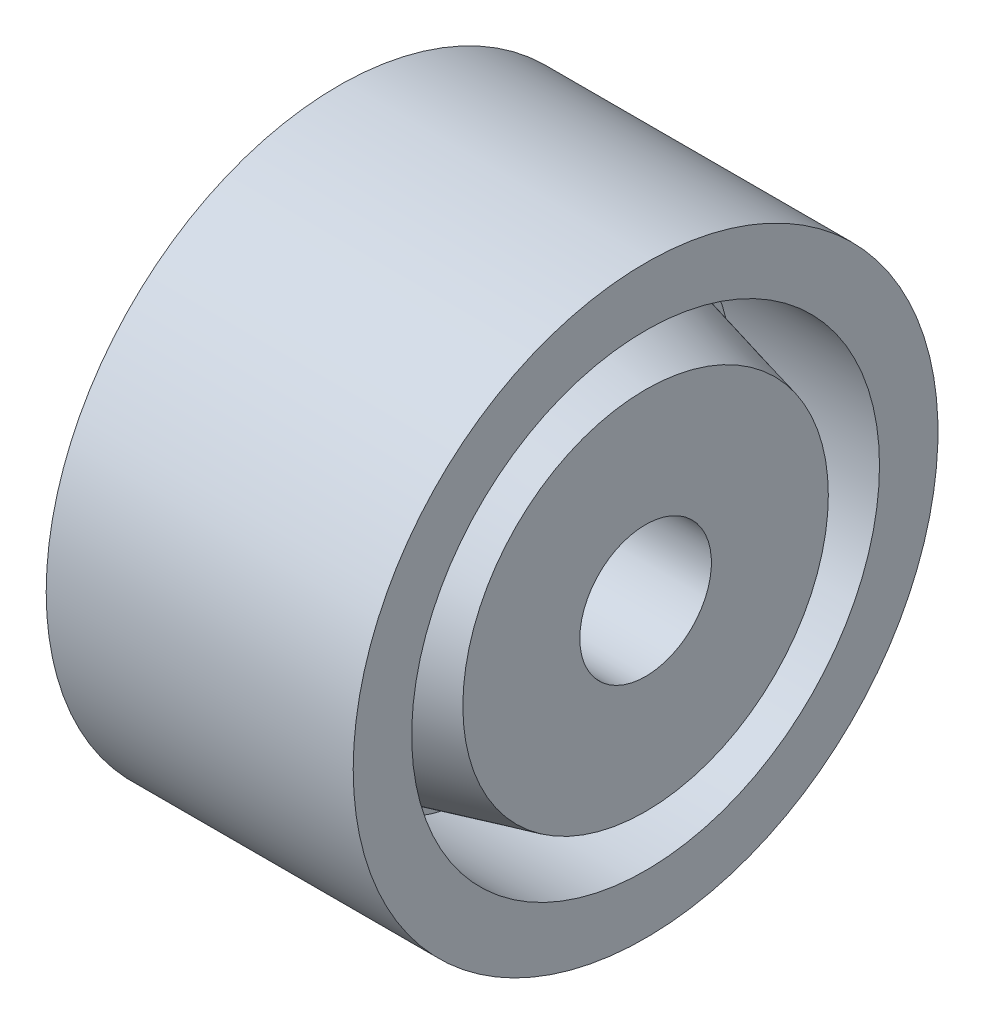
from build123d import *

# Parameters (mm, degrees)
SKETCH1_R           = 40
BOSS_EXTRUDE1_DEPTH = 42
SKETCH3_R           = 32
CUT_EXTRUDE2_DEPTH  = 20
SKETCH6_R           = 30
SKETCH5_R           = 25
SKETCH2_R           = 9
CUT_EXTRUDE4_DEPTH  = 13


with BuildPart() as part:
    # Sketch1 → Boss-Extrude1 (new body)
    with BuildSketch(Plane(origin=(0, 0, 0), x_dir=(0, 0, -1), z_dir=(1, 0, 0))):
        with Locations(Location((0, 0, 0), (0, 0, 180))):
            Circle(SKETCH1_R)
    extrude(amount=BOSS_EXTRUDE1_DEPTH)

    # Sketch3 → Cut-Extrude2 (cut)
    with BuildSketch(Plane(origin=(42, 0, 0), x_dir=(0, 0, -1), z_dir=(1, 0, 0))):
        Circle(SKETCH3_R)
    cut_extrude2 = extrude(amount=-CUT_EXTRUDE2_DEPTH, mode=Mode.SUBTRACT)

    # Sketch6 → Loft1 section 0
    with BuildSketch(Plane(origin=(22, 0, 0), x_dir=(0, 0, -1), z_dir=(1, 0, 0))):
        Circle(SKETCH6_R)
    # Sketch5 → Loft1 section 1
    with BuildSketch(Plane(origin=(42, 0, 0), x_dir=(0, 0, -1), z_dir=(1, 0, 0))):
        Circle(SKETCH5_R)
    loft1 = loft()

    # Mirror5: Cut-Extrude2, Loft1 across plane
    add(cut_extrude2.mirror(Plane(origin=(21, 0, 0), x_dir=(0, 0, 1), z_dir=(1, 0, 0))), mode=Mode.SUBTRACT)
    add(loft1.mirror(Plane(origin=(21, 0, 0), x_dir=(0, 0, 1), z_dir=(1, 0, 0))))

    # Sketch2 → Cut-Extrude4 (cut)
    with BuildSketch(Plane.ZY):
        Circle(SKETCH2_R)
    cut_extrude4 = extrude(amount=-CUT_EXTRUDE4_DEPTH, mode=Mode.SUBTRACT)

    # Mirror6: Cut-Extrude4 across plane
    add(cut_extrude4.mirror(Plane(origin=(21, 0, 0), x_dir=(0, 0, 1), z_dir=(1, 0, 0))), mode=Mode.SUBTRACT)


solid = part.part
